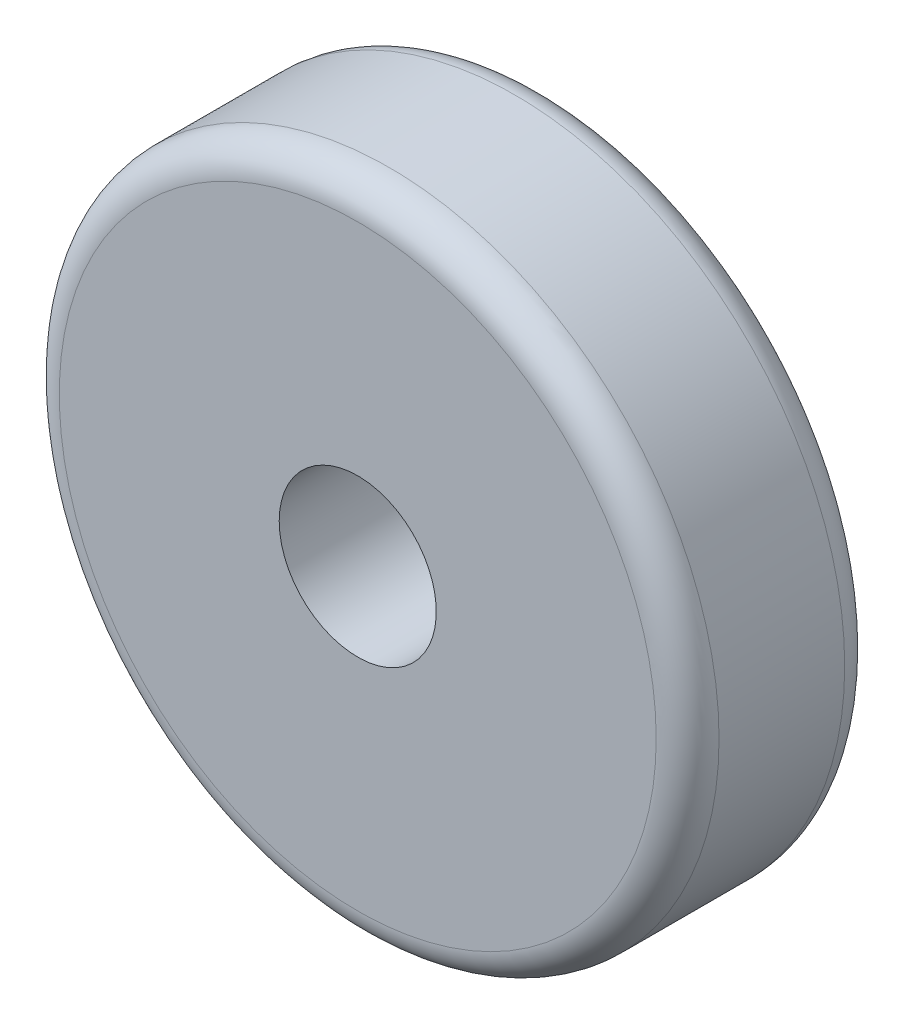
from build123d import *

# Parameters (mm, degrees)
SKETCH1_R           = 10.5
BOSS_EXTRUDE1_DEPTH = 6
SKETCH2_R           = 2.5
CUT_EXTRUDE1_DEPTH  = 6
FILLET1_R           = 1
CUT_EXTRUDE2_DEPTH  = 2


with BuildPart() as part:
    # Sketch1 → Boss-Extrude1 (new body)
    with BuildSketch(Plane.XY):
        Circle(SKETCH1_R)
    extrude(amount=BOSS_EXTRUDE1_DEPTH)

    # Sketch2 → Cut-Extrude1 (cut)
    with BuildSketch(Plane(origin=(0, 0, 0), x_dir=(-1, 0, 0), z_dir=(0, 0, -1))):
        Circle(SKETCH2_R)
    extrude(amount=-CUT_EXTRUDE1_DEPTH, mode=Mode.SUBTRACT)

    # Fillet1
    fillet1_edges = [part.edges().sort_by_distance(p)[0] for p in [
        (-10.5, 0, 0),
        (-10.5, 0, 6),
    ]]
    fillet(fillet1_edges, radius=FILLET1_R)

    # Sketch3 → Cut-Extrude2 (cut)
    with BuildSketch(Plane(origin=(0, 0, 0), x_dir=(-1, 0, 0), z_dir=(0, 0, -1))):
        with BuildLine():
            Line((-0.5, 8.986100378), (-0.5, 3.464101615))
            ThreePointArc((-0.5, 3.464101615), (-2.474873734, 2.474873734), (-3.464101615, 0.5))
            Line((-3.464101615, 0.5), (-8.986100378, 0.5))
            ThreePointArc((-8.986100378, 0.5), (-6.363961031, 6.363961031), (-0.5, 8.986100378))
        make_face()
        with BuildLine():
            Line((0.5, 8.986100378), (0.5, 3.464101615))
            ThreePointArc((0.5, 3.464101615), (2.474873734, 2.474873734), (3.464101615, 0.5))
            Line((3.464101615, 0.5), (8.986100378, 0.5))
            ThreePointArc((8.986100378, 0.5), (6.363961031, 6.363961031), (0.5, 8.986100378))
        make_face()
        with BuildLine():
            Line((-8.986100378, -0.5), (-3.464101615, -0.5))
            ThreePointArc((-3.464101615, -0.5), (-2.474873734, -2.474873734), (-0.5, -3.464101615))
            Line((-0.5, -3.464101615), (-0.5, -8.986100378))
            ThreePointArc((-0.5, -8.986100378), (-6.363961031, -6.363961031), (-8.986100378, -0.5))
        make_face()
        with BuildLine():
            Line((0.5, -3.464101615), (0.5, -8.986100378))
            ThreePointArc((0.5, -8.986100378), (6.363961031, -6.363961031), (8.986100378, -0.5))
            Line((8.986100378, -0.5), (3.464101615, -0.5))
            ThreePointArc((3.464101615, -0.5), (2.474873734, -2.474873734), (0.5, -3.464101615))
        make_face()
    extrude(amount=-CUT_EXTRUDE2_DEPTH, mode=Mode.SUBTRACT)


solid = part.part
